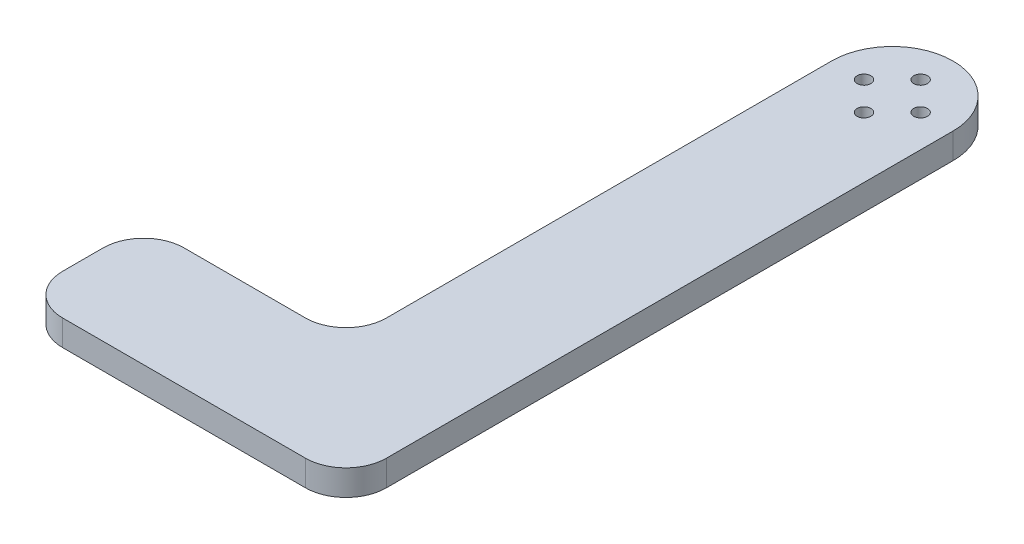
from build123d import *

# Parameters (mm, degrees)
SKETCH2_R            = 15
BOSS_EXTRUDE1_DEPTH  = 6.35
M3_CLEARANCE_HOLE1_D = 3.4
CIRPATTERN1_COUNT    = 4
FILLET1_R            = 10


with BuildPart() as part:
    # Sketch2 → Boss-Extrude1 (new body)
    with BuildSketch(Plane(origin=(0, 0, 0), x_dir=(1, 0, 0), z_dir=(0, 1, 0))):
        with BuildLine():
            ThreePointArc((15, 0), (0, -15), (-15, 0))
            Line((-15, 0), (-15, -120))
            Line((-15, -120), (-65, -120))
            Line((-65, -120), (-65, -150))
            Line((-65, -150), (15, -150))
            Line((15, -150), (15, 0))
        make_face()
        Circle(SKETCH2_R)
    extrude(amount=BOSS_EXTRUDE1_DEPTH)

    # M3 Clearance Hole1 (through all)
    with Locations(Plane(origin=(0, 6.35, 0), x_dir=(1, 0, 0), z_dir=(0, 1, 0))):
        with Locations((0, 7)):
            m3_clearance_hole1 = Hole(M3_CLEARANCE_HOLE1_D / 2)

    # CirPattern1: M3 Clearance Hole1 ×4 about axis
    cirpattern1_axis = Axis((0, 0, 0), (0, 1, 0))
    for i in range(1, CIRPATTERN1_COUNT):
        add(m3_clearance_hole1.rotate(cirpattern1_axis, i * 360 / CIRPATTERN1_COUNT), mode=Mode.SUBTRACT)

    # Fillet1
    fillet1_edges = [part.edges().sort_by_distance(p)[0] for p in [
        (15, 3.175, 150),
        (-65, 3.175, 150),
        (-65, 3.175, 120),
        (-15, 3.175, 120),
    ]]
    fillet(fillet1_edges, radius=FILLET1_R)


solid = part.part
